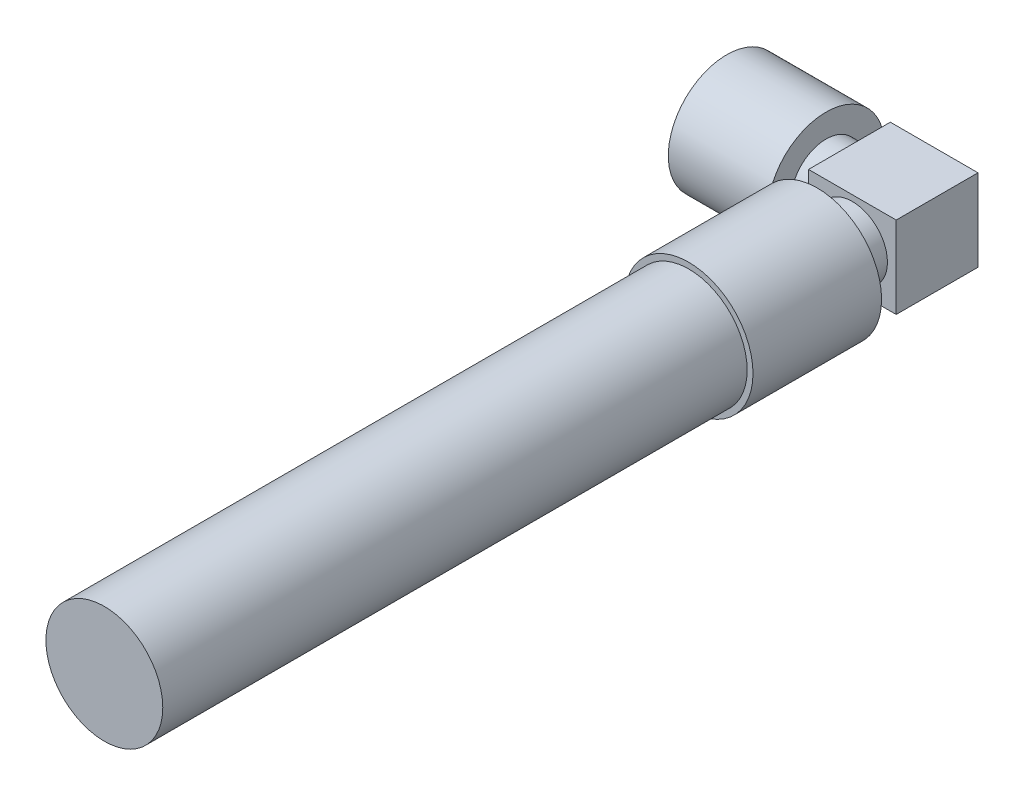
from build123d import *

# Parameters (mm, degrees)
SKETCH1_R              = 5
BARREL_CONNECTOR_DEPTH = 8.5
SKETCH2_R              = 3
BOSS_EXTRUDE2_DEPTH    = 2
SKETCH3_W              = 7
SKETCH3_H              = 7
BOSS_EXTRUDE3_DEPTH    = 7.5
SKETCH4_R              = 3
BOSS_EXTRUDE4_DEPTH    = 3
SKETCH5_R              = 5.5
BOSS_EXTRUDE5_DEPTH    = 11
SKETCH6_R              = 5
BOSS_EXTRUDE6_DEPTH    = 50


with BuildPart() as part:
    # Sketch1 → Barrel Connector (new body)
    with BuildSketch(Plane(origin=(0, 0, 0), x_dir=(0, 0, -1), z_dir=(1, 0, 0))):
        Circle(SKETCH1_R)
    extrude(amount=-BARREL_CONNECTOR_DEPTH)

    # Sketch2 → Boss-Extrude2 (add)
    with BuildSketch(Plane(origin=(0, 0, 0), x_dir=(0, 0, -1), z_dir=(1, 0, 0))):
        Circle(SKETCH2_R)
    extrude(amount=BOSS_EXTRUDE2_DEPTH)

    # Sketch3 → Boss-Extrude3 (add)
    with BuildSketch(Plane(origin=(2, 0, 0), x_dir=(0, 0, -1), z_dir=(1, 0, 0))):
        Rectangle(SKETCH3_W, SKETCH3_H)
    extrude(amount=BOSS_EXTRUDE3_DEPTH)

    # Sketch4 → Boss-Extrude4 (add)
    with BuildSketch(Plane.XY.offset(3.5)):
        with Locations((5.75, 0)):
            Circle(SKETCH4_R)
    extrude(amount=BOSS_EXTRUDE4_DEPTH)

    # Sketch5 → Boss-Extrude5 (add)
    with BuildSketch(Plane.XY.offset(6.5)):
        with Locations((5.75, 0)):
            Circle(SKETCH5_R)
    extrude(amount=BOSS_EXTRUDE5_DEPTH)

    # Sketch6 → Boss-Extrude6 (add)
    with BuildSketch(Plane.XY.offset(17.5)):
        with Locations((5.75, 0)):
            Circle(SKETCH6_R)
    extrude(amount=BOSS_EXTRUDE6_DEPTH)


solid = part.part
